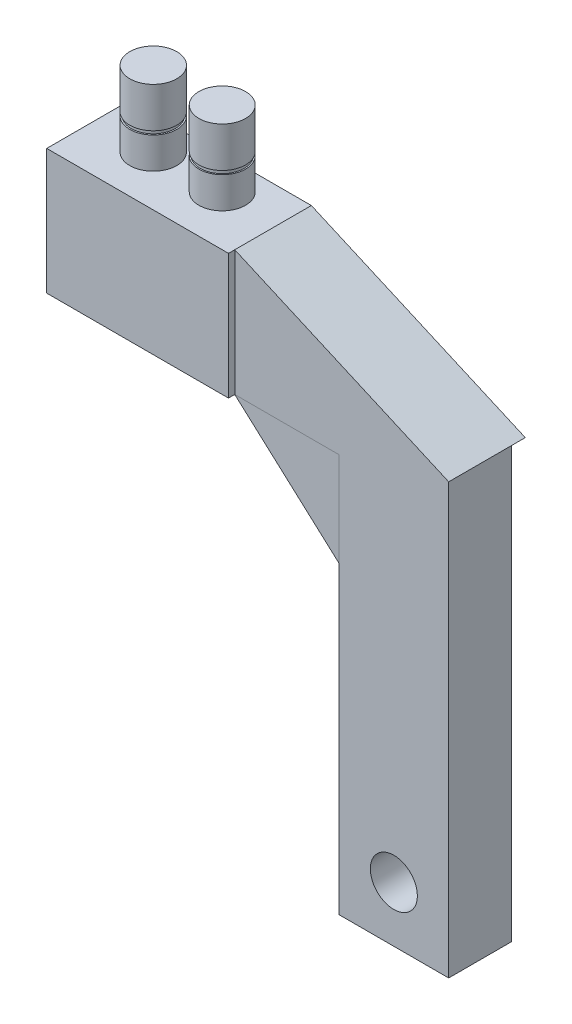
from build123d import *

# Parameters (mm, degrees)
SKETCH1_W            = 36.83
SKETCH1_H            = 20.32
BOSS_EXTRUDE1_DEPTH  = 25.4
SKETCH2_W            = 12.7
SKETCH2_H            = 6.35
BOSS_EXTRUDE2_DEPTH  = 43.344230304
SKETCH3_W            = 22.225
SKETCH3_H            = 12.7
BOSS_EXTRUDE3_DEPTH  = 80.713490592
SKETCH4_R            = 4.7625
CUT_EXTRUDE1_DEPTH   = 125.246440244
SKETCH5_R            = 4.7625
SKETCH5_R_2          = 4.729383401
BOSS_EXTRUDE4_DEPTH  = 15.24
BOSS_EXTRUDE5_DEPTH  = 20.32
SKETCH8_W            = 43.344230304
SKETCH8_H            = 1.27
CUT_EXTRUDE2_DEPTH   = 108.226300513
BOSS_EXTRUDE10_DEPTH = 20.32
F_3DSKETCH3_R        = 5.08
CUT_EXTRUDE4_DEPTH   = 0.7366
SKETCH14_R           = 4.4704
BOSS_EXTRUDE11_DEPTH = 0.7366
SKETCH16_W           = 217.351888632
SKETCH16_H           = 211.359138863
CUT_EXTRUDE5_DEPTH   = 4.8028352


with BuildPart() as part:
    # Sketch1 → Boss-Extrude1 (new body)
    with BuildSketch(Plane(origin=(0, 0, 0), x_dir=(1, 0, 0), z_dir=(0, 1, 0))):
        Rectangle(SKETCH1_W, SKETCH1_H)
    extrude(amount=-BOSS_EXTRUDE1_DEPTH)

    # Sketch2 → Boss-Extrude2 (add)
    with BuildSketch(Plane(origin=(18.415, 0, 0), x_dir=(0, 0, -1), z_dir=(1, 0, 0))):
        with Locations((-2.54, -22.225)):
            Rectangle(SKETCH2_W, SKETCH2_H)
    extrude(amount=BOSS_EXTRUDE2_DEPTH)

    # Sketch3 → Boss-Extrude3 (add)
    with BuildSketch(Plane(origin=(0, -25.4, 0), x_dir=(-1, 0, 0), z_dir=(0, -1, 0))):
        with Locations((-50.646730304, -2.54)):
            Rectangle(SKETCH3_W, SKETCH3_H)
    extrude(amount=BOSS_EXTRUDE3_DEPTH)

    # Sketch4 → Cut-Extrude1 (cut, through all)
    with BuildSketch(Plane.XY.offset(8.89)):
        with Locations((50.646730304, -94.884200122)):
            Circle(SKETCH4_R)
    extrude(amount=-CUT_EXTRUDE1_DEPTH, mode=Mode.SUBTRACT)

    # Sketch5 → Boss-Extrude4 (add)
    with BuildSketch(Plane(origin=(0, 0, 0), x_dir=(1, 0, 0), z_dir=(0, 1, 0))):
        with Locations(Location((-6.985, 0, 0), (0, 0, 90))):
            Circle(SKETCH5_R)
        with Locations(Location((6.985, 0, 0), (0, 0, 90))):
            Circle(SKETCH5_R_2)
    extrude(amount=BOSS_EXTRUDE4_DEPTH)

    # Sketch7 → Boss-Extrude5 (add)
    with BuildSketch(Plane.XY.offset(10.16)):
        Polygon((18.415, 0), (61.759230304, -19.05), (18.415, -19.05), align=None)
    extrude(amount=-BOSS_EXTRUDE5_DEPTH)

    # Sketch8 → Cut-Extrude2 (cut, through all)
    with BuildSketch(Plane(origin=(0, -19.05, 0), x_dir=(-1, 0, 0), z_dir=(0, -1, 0))):
        with Locations((-40.087115152, -9.525)):
            Rectangle(SKETCH8_W, SKETCH8_H)
    extrude(amount=-CUT_EXTRUDE2_DEPTH, mode=Mode.SUBTRACT)

    # 3DSketch3 → Cut-Extrude4 (cut)
    with BuildSketch(Plane(origin=(-6.985, 6.35, 0), x_dir=(1, 0, 0), z_dir=(0, -1, 0))):
        Circle(F_3DSKETCH3_R)
        with Locations((13.97, 0)):
            Circle(F_3DSKETCH3_R)
    extrude(amount=-CUT_EXTRUDE4_DEPTH, mode=Mode.SUBTRACT)


with BuildPart() as body_2:
    # Sketch13 → Boss-Extrude10 (new body)
    with BuildSketch(Plane.XY.offset(8.89)):
        Polygon((18.415, -25.4), (39.534230304, -25.4), (39.534230304, -44.45), align=None)
    extrude(amount=-BOSS_EXTRUDE10_DEPTH)


with BuildPart() as cut_extrude4_piece_1:
    # of the separate pieces the step leaves, piece 1, a body of its own (cut_extrude4_pieces)
    add(part.part.solids().sort_by_distance((18.415, 0, 10.16))[0])



with BuildPart() as cut_extrude4_piece_2:
    # of the separate pieces the step leaves, piece 2, a body of its own (cut_extrude4_pieces)
    add(part.part.solids().sort_by_distance((-6.985, 7.0866, -4.7625))[0])


with BuildPart() as cut_extrude4_piece_3:
    # of the separate pieces the step leaves, piece 3, a body of its own (cut_extrude4_pieces)
    add(part.part.solids().sort_by_distance((6.985, 7.0866, -4.729383401))[0])


with BuildPart() as cut_extrude4_piece_1_1:
    add(cut_extrude4_piece_1.part)

    add(cut_extrude4_piece_2.part)  # Boss-Extrude11 merges Cut-Extrude4 piece 2

    add(cut_extrude4_piece_3.part)  # Boss-Extrude11 merges Cut-Extrude4 piece 3
    # Sketch14 → Boss-Extrude11 (add)
    with BuildSketch(Plane(origin=(0, 6.35, 0), x_dir=(1, 0, 0), z_dir=(0, 1, 0))):
        with Locations(Location((-6.985, 0, 0), (0, 0, 270))):
            Circle(SKETCH14_R)
        with Locations(Location((6.985, 0, 0), (0, 0, 270))):
            Circle(SKETCH14_R)
    extrude(amount=BOSS_EXTRUDE11_DEPTH)


with BuildPart() as cut_extrude5_tool:
    # Sketch16 → Cut-Extrude5 (new body)
    with BuildSketch(Plane(origin=(0, 0, -11.43), x_dir=(-1, 0, 0), z_dir=(0, 0, -1))):
        with Locations((-28.335198099, -31.581377013)):
            Rectangle(SKETCH16_W, SKETCH16_H)
    extrude(amount=-CUT_EXTRUDE5_DEPTH)


with BuildPart() as body_2_1:
    add(body_2.part)

    # Cut-Extrude5: cut by cut_extrude5_tool
    add(cut_extrude5_tool.part, mode=Mode.SUBTRACT)


with BuildPart() as cut_extrude4_piece_1_2:
    add(cut_extrude4_piece_1_1.part)

    # Cut-Extrude5: cut by cut_extrude5_tool
    add(cut_extrude5_tool.part, mode=Mode.SUBTRACT)


solid = Compound([body_2_1.part, cut_extrude4_piece_1_2.part])
